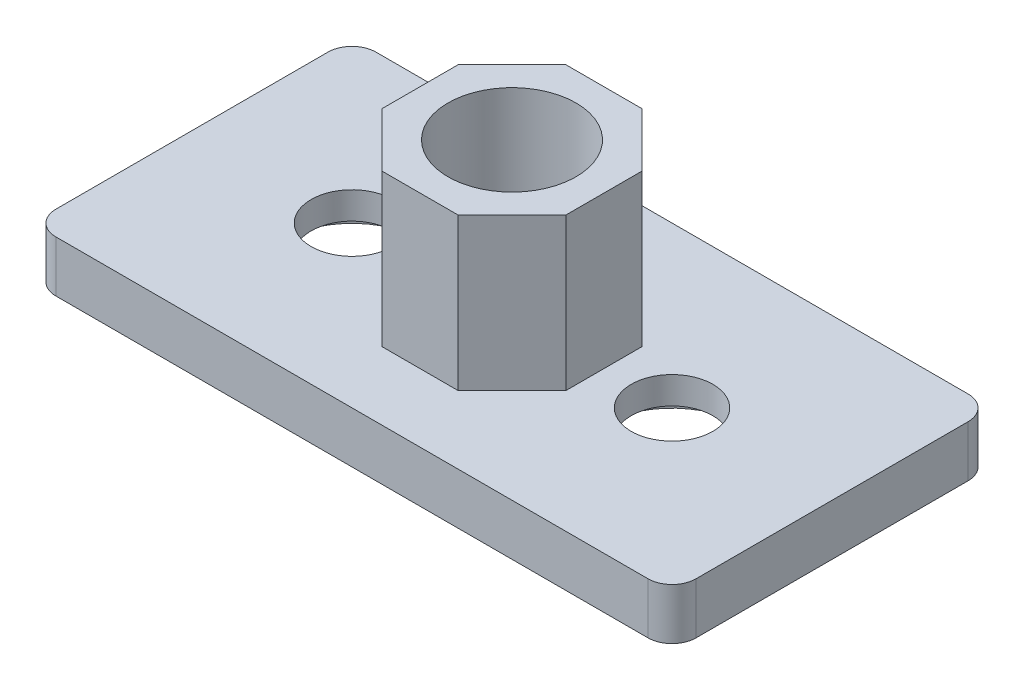
from build123d import *

# Parameters (mm, degrees)
SKETCH1_W                = 40
SKETCH1_H                = 20
BOSS_EXTRUDE1_DEPTH      = 3.2
BOSS_EXTRUDE2_DEPTH      = 9.5
F_8_0_8_DIAMETER_HOLE1_D = 8
HOLE1_D                  = 5.1
HOLE1_DEPTH              = 12.7
HOLE1_CBORE_D            = 9
HOLE1_CBORE_DEPTH        = 1.5
FILLET1_R                = 1.5


with BuildPart() as part:
    # Sketch1 → Boss-Extrude1 (new body)
    with BuildSketch(Plane.XZ.offset(1.6)):
        with Locations((0, 10)):
            Rectangle(SKETCH1_W, SKETCH1_H)
    extrude(amount=-BOSS_EXTRUDE1_DEPTH)

    # Sketch2 → Boss-Extrude2 (add)
    with BuildSketch(Plane(origin=(0, 1.6, 0), x_dir=(-1, 0, 0), z_dir=(0, 1, 0))):
        Polygon((-5.75, 12.381727984), (-2.381727984, 15.75), (2.381727984, 15.75), (5.75, 12.381727984), (5.75, 7.618272016), (2.381727984, 4.25), (-2.381727984, 4.25), (-5.75, 7.618272016), align=None)
    extrude(amount=BOSS_EXTRUDE2_DEPTH)

    # Ø8.0 (8) Diameter Hole1 (through all)
    with Locations(Plane(origin=(0, -1.6, 0), x_dir=(-1, 0, 0), z_dir=(0, -1, 0))):
        with Locations((0, -10)):
            Hole(F_8_0_8_DIAMETER_HOLE1_D / 2)

    # Hole1
    with Locations(Plane(origin=(0, -1.6, 0), x_dir=(-1, 0, 0), z_dir=(0, -1, 0))):
        with Locations((10, -10), (-10, -10)):
            CounterBoreHole(HOLE1_D / 2, HOLE1_CBORE_D / 2, HOLE1_CBORE_DEPTH, depth=HOLE1_DEPTH)

    # Fillet1
    fillet1_edges = [part.edges().sort_by_distance(p)[0] for p in [
        (-20, 0, 20),
        (20, 0, 20),
        (20, 0, 0),
        (-20, 0, 0),
    ]]
    fillet(fillet1_edges, radius=FILLET1_R)


solid = part.part
